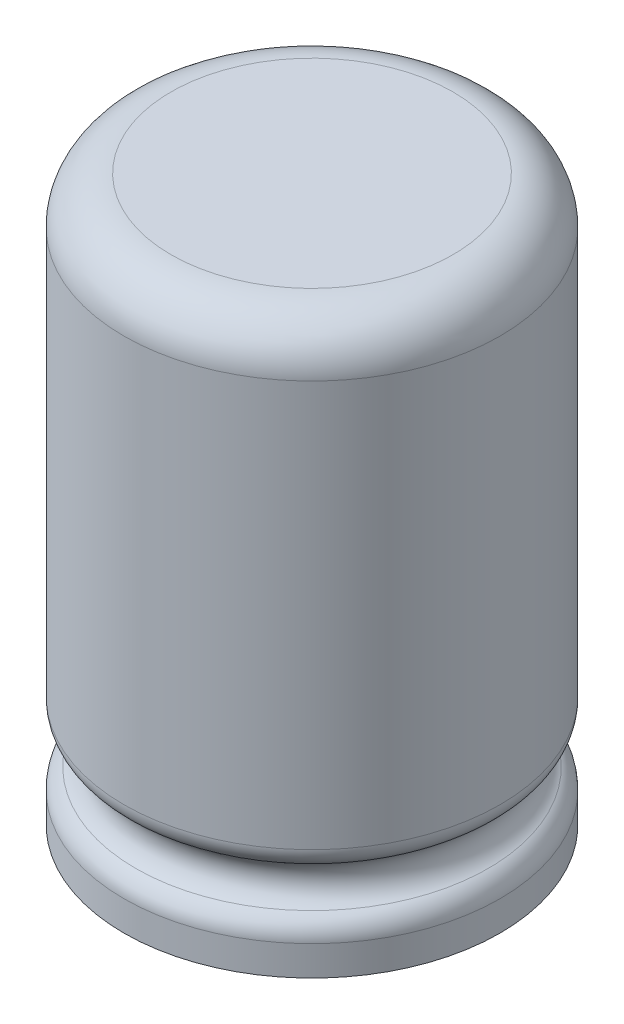
from build123d import *

# Parameters (mm, degrees)
FILLET1_R = 0.5


with BuildPart() as part:
    # Sketch1 → Revolve1 (revolve)
    with BuildSketch(Plane.XY, mode=Mode.PRIVATE) as revolve1_sk:
        with BuildLine():
            Line((0, 0), (4, 0))
            Line((4, 0), (4, 1))
            ThreePointArc((4, 1), (3.5, 1.5), (4, 2))
            Line((4, 2), (4, 11))
            ThreePointArc((4, 11), (3.707106781, 11.707106781), (3, 12))
            Line((3, 12), (0, 12))
            Line((0, 12), (0, 0))
        make_face()
    revolve(revolve1_sk.sketch.rotate(Axis((0, -5.130376558, 0), (0, 1, 0)), 90), axis=Axis((0, -5.130376558, 0), (0, 1, 0)))

    # Fillet1
    fillet1_edges = [part.edges().sort_by_distance(p)[0] for p in [
        (0, 2, 4),
        (0, 1, 4),
    ]]
    fillet(fillet1_edges, radius=FILLET1_R)


solid = part.part
